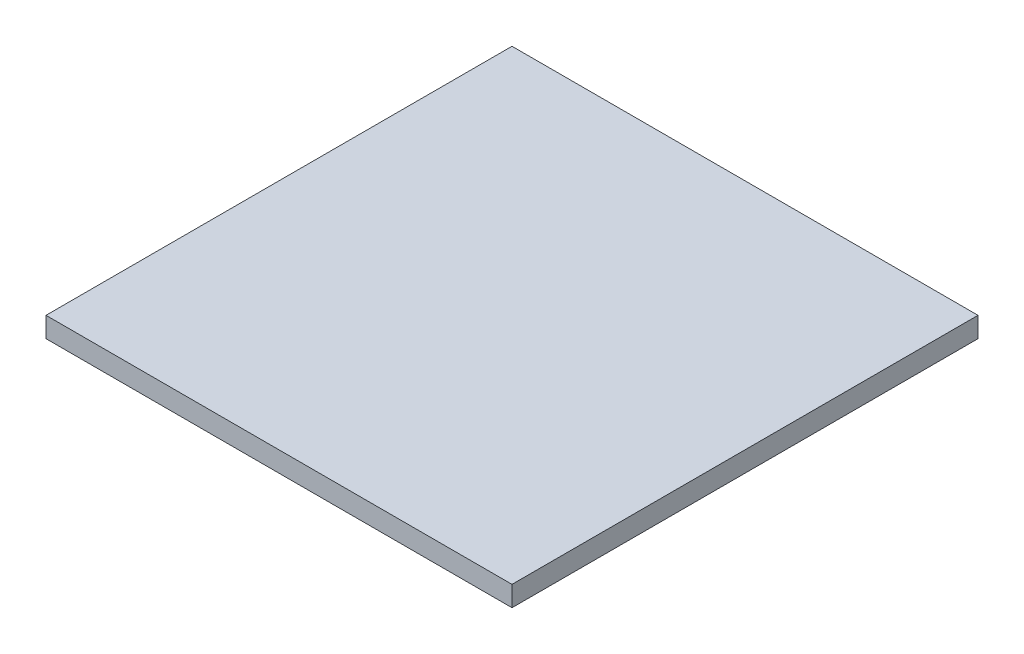
from build123d import *

# Parameters (mm, degrees)
SKETCH1_W           = 92
SKETCH1_H           = 92
BOSS_EXTRUDE1_DEPTH = 4


with BuildPart() as part:
    # Sketch1 → Boss-Extrude1 (new body)
    with BuildSketch(Plane(origin=(0, 0, 0), x_dir=(1, 0, 0), z_dir=(0, 1, 0))):
        Rectangle(SKETCH1_W, SKETCH1_H)
    extrude(amount=BOSS_EXTRUDE1_DEPTH)


solid = part.part
